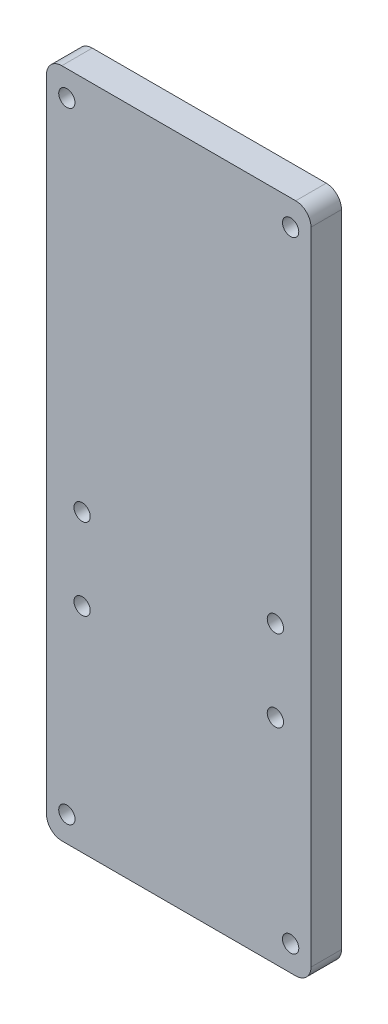
from build123d import *

# Parameters (mm, degrees)
SKETCH1_R           = 1.6
BOSS_EXTRUDE1_DEPTH = 6


with BuildPart() as part:
    # Sketch1 → Boss-Extrude1 (new body)
    with BuildSketch(Plane.XY):
        with BuildLine():
            Line((23.206941284, 124.936391703), (23.206941284, -1.063608297))
            ThreePointArc((23.206941284, -1.063608297), (24.085620941, -3.184928641), (26.206941284, -4.063608297))
            Line((26.206941284, -4.063608297), (72.208519176, -4.063608297))
            ThreePointArc((72.208519176, -4.063608297), (74.32983952, -3.184928641), (75.208519176, -1.063608297))
            Line((75.208519176, -1.063608297), (75.208519176, 124.936391703))
            ThreePointArc((75.208519176, 124.936391703), (74.32983952, 127.057712046), (72.208519176, 127.936391703))
            Line((72.208519176, 127.936391703), (26.206941284, 127.936391703))
            ThreePointArc((26.206941284, 127.936391703), (24.085620941, 127.057712046), (23.206941284, 124.936391703))
        make_face()
        with Locations((30.20773023, 53.936391703)):
            Circle(SKETCH1_R, mode=Mode.SUBTRACT)
        with Locations((27.206941284, 0.936391703)):
            Circle(SKETCH1_R, mode=Mode.SUBTRACT)
        with Locations((30.20773023, 37.936391703)):
            Circle(SKETCH1_R, mode=Mode.SUBTRACT)
        with Locations((71.208519176, 122.936391703)):
            Circle(SKETCH1_R, mode=Mode.SUBTRACT)
        with Locations(Location((71.208519176, 0.936391703, 0), (0, 0, 180))):
            Circle(SKETCH1_R, mode=Mode.SUBTRACT)
        with Locations(Location((68.20773023, 53.936391703, 0), (0, 0, 180))):
            Circle(SKETCH1_R, mode=Mode.SUBTRACT)
        with Locations(Location((27.206941284, 122.936391703, 0), (0, 0, 180))):
            Circle(SKETCH1_R, mode=Mode.SUBTRACT)
        with Locations((68.20773023, 37.936391703)):
            Circle(SKETCH1_R, mode=Mode.SUBTRACT)
    extrude(amount=BOSS_EXTRUDE1_DEPTH)


solid = part.part
